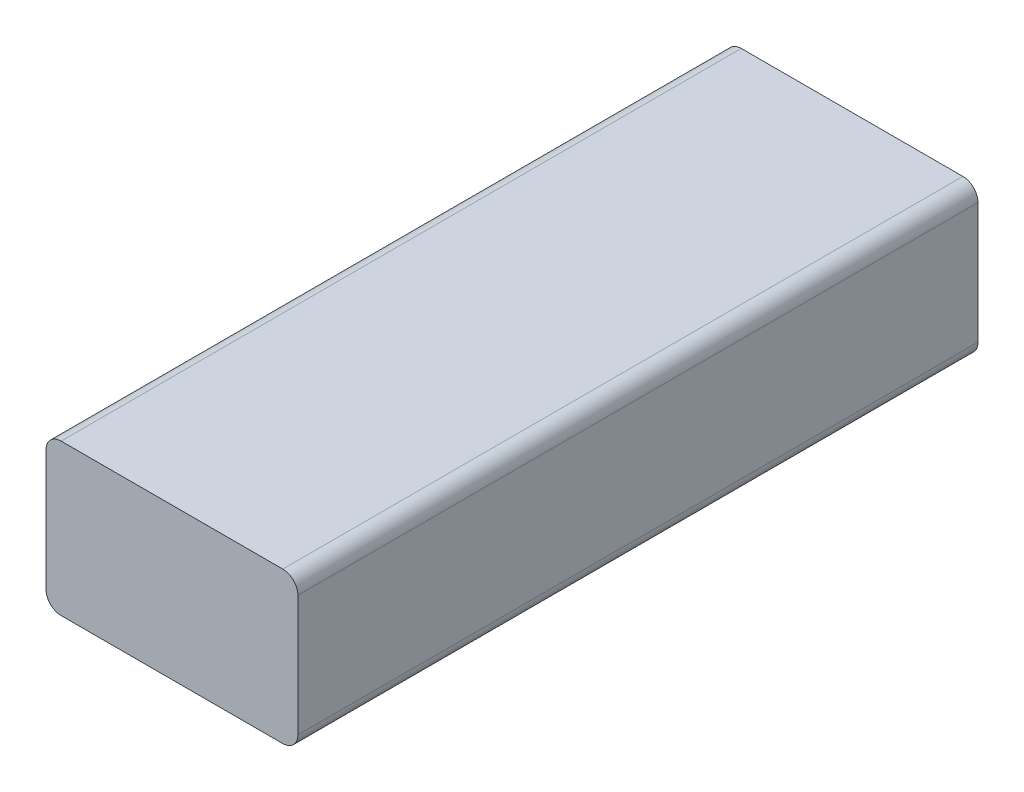
from build123d import *

# Parameters (mm, degrees)
SKETCH_1_W      = 135
SKETCH_1_H      = 30
EXTRUDE_1_DEPTH = 50
FILLET_1_R      = 3


with BuildPart() as part:
    # 草图1 → 凸台-拉伸1 (new body)
    with BuildSketch(Plane(origin=(0, 0, 0), x_dir=(0, 0, -1), z_dir=(1, 0, 0))):
        Rectangle(SKETCH_1_W, SKETCH_1_H)
    extrude(amount=EXTRUDE_1_DEPTH)

    # 圆角1
    fillet_1_edges = [part.edges().sort_by_distance(p)[0] for p in [
        (50, -15, 0),
        (0, -15, 0),
        (0, 15, 0),
        (50, 15, 0),
    ]]
    fillet(fillet_1_edges, radius=FILLET_1_R)


solid = part.part
